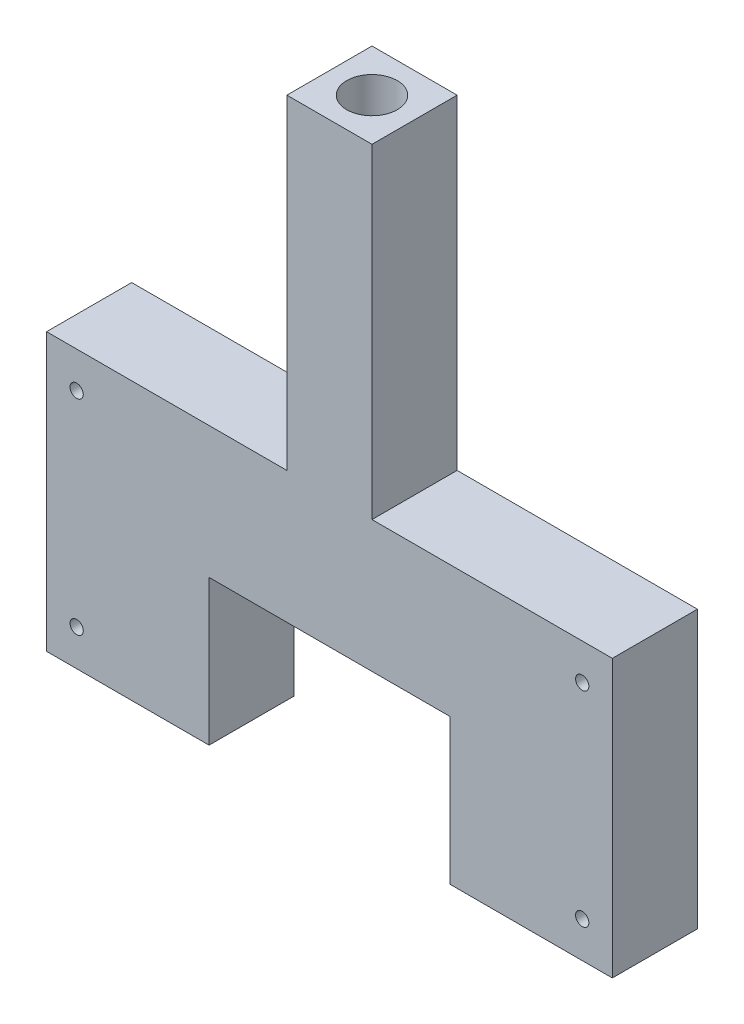
from build123d import *

# Parameters (mm, degrees)
ESQUISSE1_W               = 47
ESQUISSE1_H               = 23
BOSS_EXTRU_1_DEPTH        = 7.071067812
TROU_TARAUD_M1_4X0_32_D   = 1.1
ESQUISSE5_W               = 20
ESQUISSE5_H               = 15
ENL_V_MAT_EXTRU_1_DEPTH   = 7.071067812
ESQUISSE6_W               = 20
ESQUISSE6_H               = 10.927419914
BOSS_EXTRU_2_DEPTH        = 7.071067812
ESQUISSE9_W               = 7.071067812
ESQUISSE9_H               = 7.071067812
BOSS_EXTRU_5_DEPTH        = 27
ESQUISSE10_R              = 1.5
ENL_V_MAT_EXTRU_2_DEPTH   = 3
TROU_TARAUD_M5X0_81_D     = 4.2
TROU_TARAUD_M5X0_81_DEPTH = 15
TROU_TARAUD_M5X0_81_TIP   = 1.2618073


with BuildPart() as part:
    # Esquisse1 → Boss.-Extru.1 (new body)
    with BuildSketch(Plane.XY):
        Rectangle(ESQUISSE1_W, ESQUISSE1_H)
    extrude(amount=BOSS_EXTRU_1_DEPTH)

    # Trou taraudé M1.4x0.32 (through all)
    with Locations(Plane(origin=(-21, 8.5, 7.071067812), x_dir=(1, 0, 0), z_dir=(0, 0, 1))):
        with Locations((0, 0), (0, -17), (42, -17), (42, 0)):
            Hole(TROU_TARAUD_M1_4X0_32_D / 2)

    # Esquisse5 → Enlèv. mat.-Extru.1 (cut)
    with BuildSketch(Plane.XY.offset(7.071067812)):
        with Locations((0, -6.927419914)):
            Rectangle(ESQUISSE5_W, ESQUISSE5_H)
    extrude(amount=-ENL_V_MAT_EXTRU_1_DEPTH, mode=Mode.SUBTRACT)

    # Esquisse6 → Boss.-Extru.2 (add)
    with BuildSketch(Plane(origin=(0, 0, 0), x_dir=(-1, 0, 0), z_dir=(0, 0, -1))):
        with Locations((0, 6.036290043)):
            Rectangle(ESQUISSE6_W, ESQUISSE6_H)
    extrude(amount=-BOSS_EXTRU_2_DEPTH)

    # Esquisse9 → Boss.-Extru.5 (add)
    with BuildSketch(Plane(origin=(0, 11.5, 0), x_dir=(1, 0, 0), z_dir=(0, 1, 0))):
        with Locations((0, -3.535533906)):
            Rectangle(ESQUISSE9_W, ESQUISSE9_H)
    extrude(amount=BOSS_EXTRU_5_DEPTH)

    # Esquisse10 → Enlèv. mat.-Extru.2 (cut)
    with BuildSketch(Plane(origin=(0, 38.5, 0), x_dir=(1, 0, 0), z_dir=(0, 1, 0))):
        with Locations(Location((0, -3.535533906, 0), (0, 0, 270))):
            Circle(ESQUISSE10_R)
    extrude(amount=-ENL_V_MAT_EXTRU_2_DEPTH, mode=Mode.SUBTRACT)

    # Trou taraudé M5x0.81
    with Locations(Plane(origin=(0, 38.5, 3.535533906), x_dir=(0, 0, 1), z_dir=(0, 1, 0))):
        with Locations((0, 0)):
            Hole(TROU_TARAUD_M5X0_81_D / 2, depth=TROU_TARAUD_M5X0_81_DEPTH)
            with Locations((0, 0, -(TROU_TARAUD_M5X0_81_DEPTH + TROU_TARAUD_M5X0_81_TIP / 2))):  # 118° drill point
                Cone(0, TROU_TARAUD_M5X0_81_D / 2, TROU_TARAUD_M5X0_81_TIP, mode=Mode.SUBTRACT)


solid = part.part
